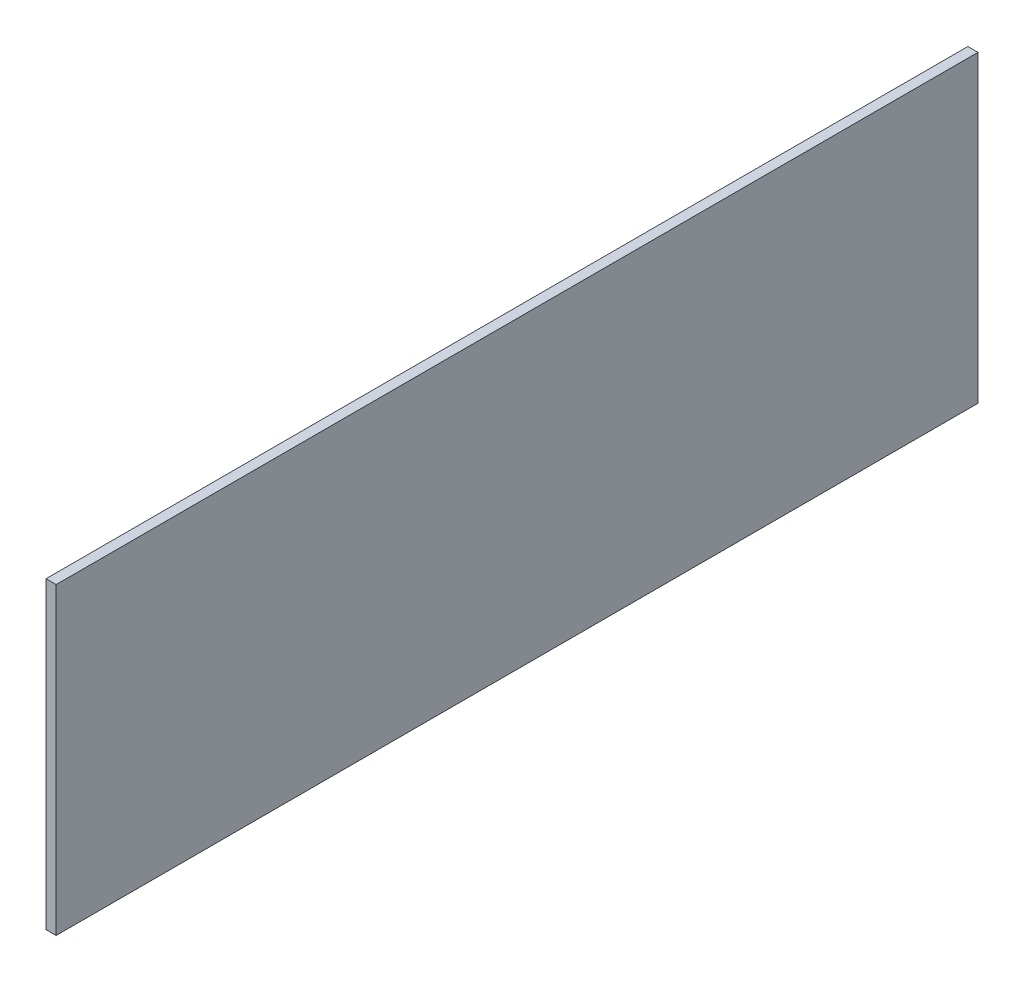
from build123d import *

# Parameters (mm, degrees)
SKETCH1_W           = 182
SKETCH1_H           = 60
BOSS_EXTRUDE1_DEPTH = 2


with BuildPart() as part:
    # Sketch1 → Boss-Extrude1 (new body)
    with BuildSketch(Plane(origin=(60, 0, 0), x_dir=(0, 0, -1), z_dir=(1, 0, 0))):
        with Locations((1, 30)):
            Rectangle(SKETCH1_W, SKETCH1_H)
    extrude(amount=BOSS_EXTRUDE1_DEPTH)


solid = part.part
